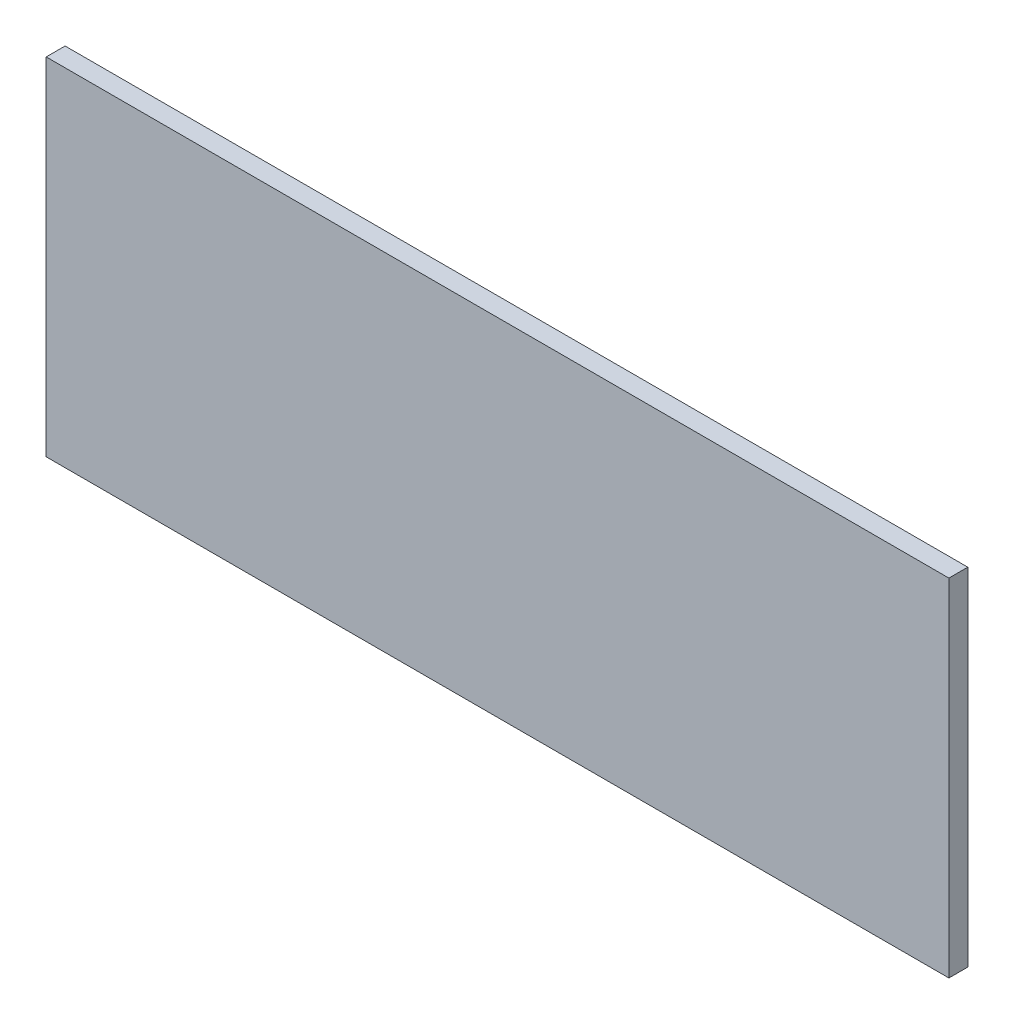
from build123d import *

# Parameters (mm, degrees)
SKETCH1_W           = 219.71
SKETCH1_H           = 84.300000056
BOSS_EXTRUDE1_DEPTH = 4.599999944


with BuildPart() as part:
    # Sketch1 → Boss-Extrude1 (new body)
    with BuildSketch(Plane.XY):
        with Locations((109.855, 42.150000028)):
            Rectangle(SKETCH1_W, SKETCH1_H)
    extrude(amount=BOSS_EXTRUDE1_DEPTH)


solid = part.part
